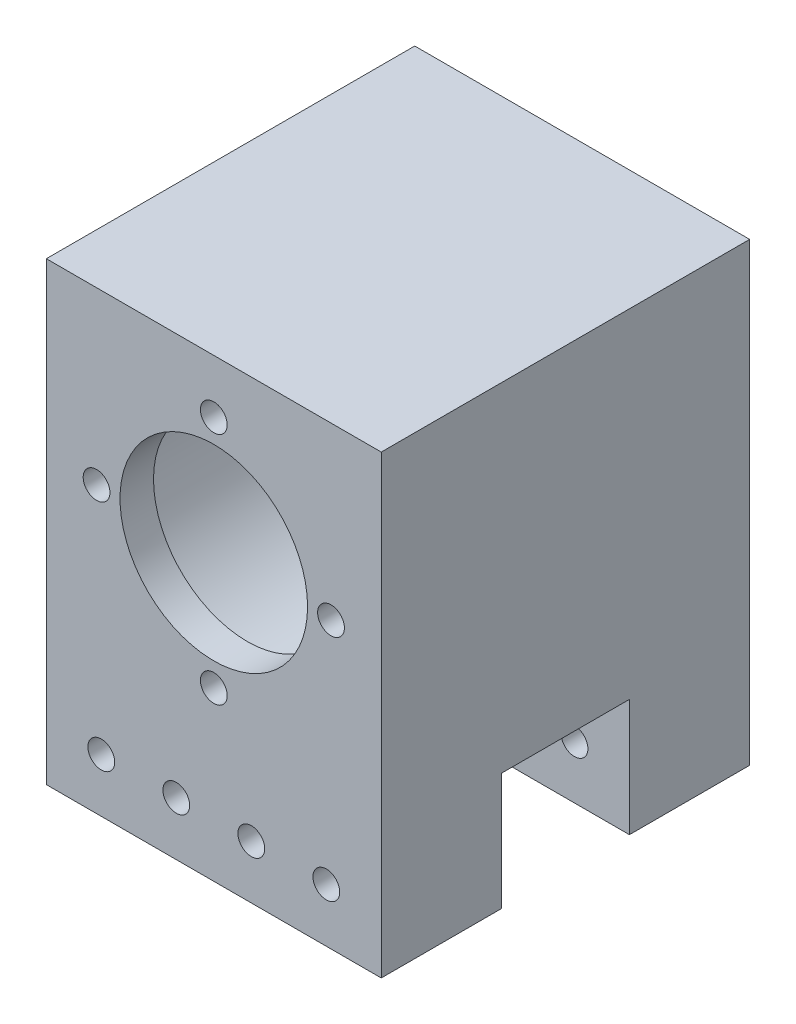
from build123d import *

# Parameters (mm, degrees)
SKETCH1_W           = 50
SKETCH1_H           = 55
BOSS_EXTRUDE1_DEPTH = 68
SKETCH3_R           = 21.125
CUT_EXTRUDE1_DEPTH  = 50
SKETCH2_R           = 14
SKETCH2_R_2         = 2
CUT_EXTRUDE2_DEPTH  = 91.96153033
SKETCH4_W           = 19.1
SKETCH4_H           = 17.5
CUT_EXTRUDE3_DEPTH  = 89.770772217
SKETCH5_R           = 2
CUT_EXTRUDE4_DEPTH  = 91.96153033


with BuildPart() as part:
    # Sketch1 → Boss-Extrude1 (new body)
    with BuildSketch(Plane(origin=(0, 0, 0), x_dir=(1, 0, 0), z_dir=(0, 1, 0))):
        Rectangle(SKETCH1_W, SKETCH1_H)
    extrude(amount=BOSS_EXTRUDE1_DEPTH)

    # Sketch3 → Cut-Extrude1 (cut)
    with BuildSketch(Plane(origin=(0, 0, -27.5), x_dir=(-1, 0, 0), z_dir=(0, 0, -1))):
        with Locations((0, 42.5)):
            Circle(SKETCH3_R)
    extrude(amount=-CUT_EXTRUDE1_DEPTH, mode=Mode.SUBTRACT)

    # Sketch2 → Cut-Extrude2 (cut, through all)
    with BuildSketch(Plane.XY.offset(27.5)):
        with Locations((0, 42.5)):
            Circle(SKETCH2_R)
        with Locations((0, 60)):
            Circle(SKETCH2_R_2)
        with Locations((17.5, 42.5)):
            Circle(SKETCH2_R_2)
        with Locations((0, 25)):
            Circle(SKETCH2_R_2)
        with Locations((-17.5, 42.5)):
            Circle(SKETCH2_R_2)
    extrude(amount=-CUT_EXTRUDE2_DEPTH, mode=Mode.SUBTRACT)

    # Sketch4 → Cut-Extrude3 (cut, through all)
    with BuildSketch(Plane(origin=(25, 0, 0), x_dir=(0, 0, -1), z_dir=(1, 0, 0))):
        with Locations((0, 8.75)):
            Rectangle(SKETCH4_W, SKETCH4_H)
    extrude(amount=-CUT_EXTRUDE3_DEPTH, mode=Mode.SUBTRACT)

    # Sketch5 → Cut-Extrude4 (cut, through all)
    with BuildSketch(Plane.XY.offset(27.5)):
        with Locations((-16.8, 8)):
            Circle(SKETCH5_R)
        with Locations((-5.6, 8)):
            Circle(SKETCH5_R)
        with Locations((5.6, 8)):
            Circle(SKETCH5_R)
        with Locations((16.8, 8)):
            Circle(SKETCH5_R)
    extrude(amount=-CUT_EXTRUDE4_DEPTH, mode=Mode.SUBTRACT)


solid = part.part
